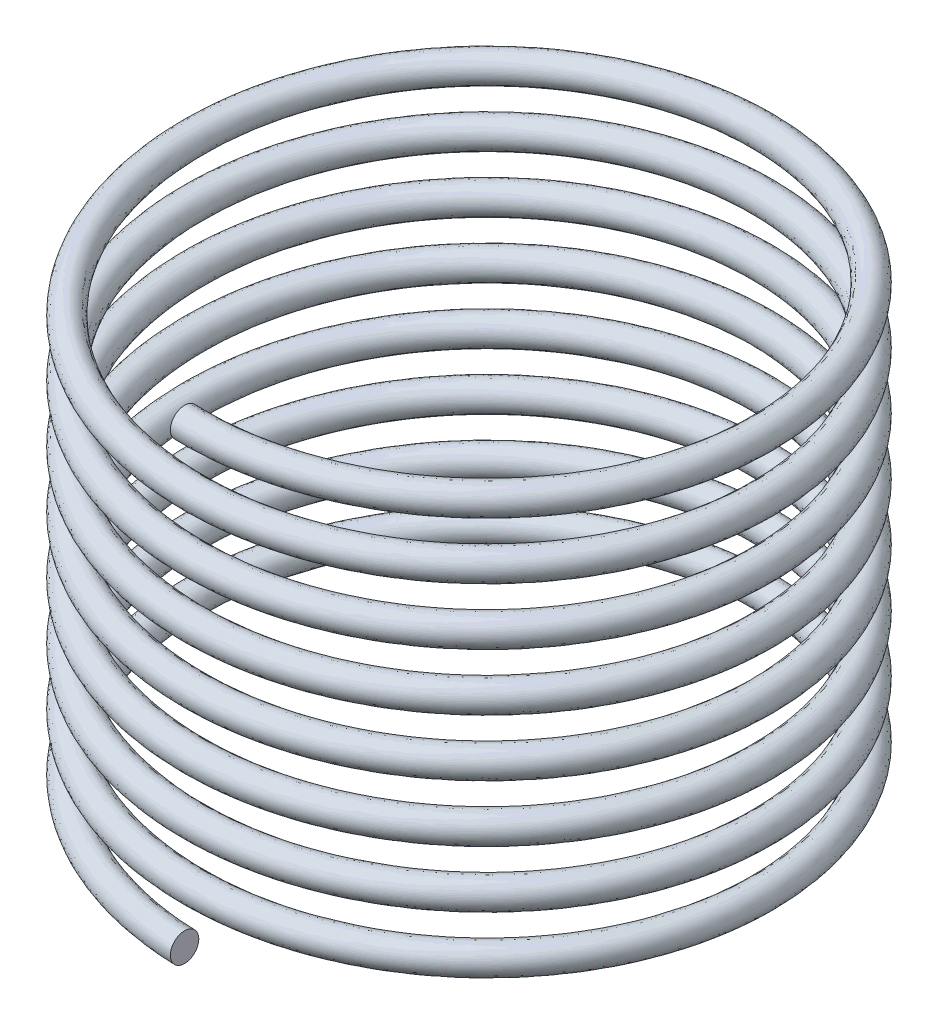
from build123d import *

# Parameters (mm, degrees)
SWEEP1_PITCH  = 10
SWEEP1_HEIGHT = 80
SWEEP1_RADIUS = 50
SKETCH3_R     = 2.5


with BuildPart() as part:
    # Sweep1: sweep along a helix
    with BuildLine() as sweep1_path:
        Helix(SWEEP1_PITCH, SWEEP1_HEIGHT, SWEEP1_RADIUS, center=(0, 0, 0), direction=(0, 1, 0), lefthand=True)
    # Sketch3 → Sweep1 (sweep)
    with BuildSketch(Plane(origin=(0, 0, 0), x_dir=(0, 0, -1), z_dir=(1, 0, 0))):
        with Locations((-50, 0)):
            Circle(SKETCH3_R)
    sweep(path=sweep1_path.line, is_frenet=True)


solid = part.part
